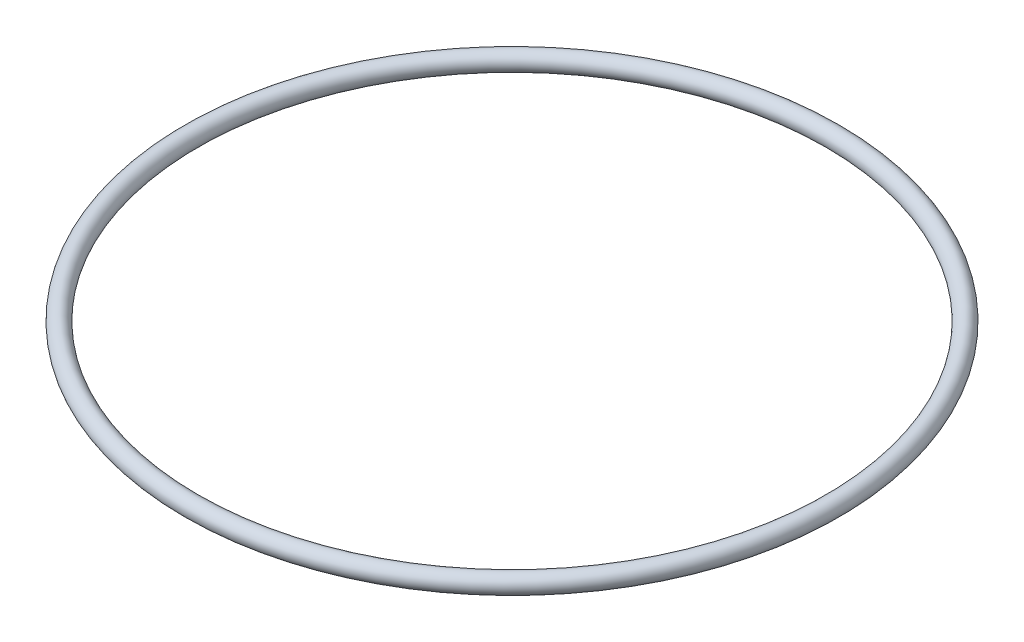
from build123d import *

# Parameters (mm, degrees)
SKETCH1_R = 1


with BuildPart() as part:
    # Sketch1 → Revolve1 (revolve)
    with BuildSketch(Plane.XY, mode=Mode.PRIVATE) as revolve1_sk:
        with Locations((35, 0)):
            Circle(SKETCH1_R)
    revolve(revolve1_sk.sketch.rotate(Axis((0, 0, 0), (0, 1, 0)), 90), axis=Axis((0, 0, 0), (0, 1, 0)))


solid = part.part
